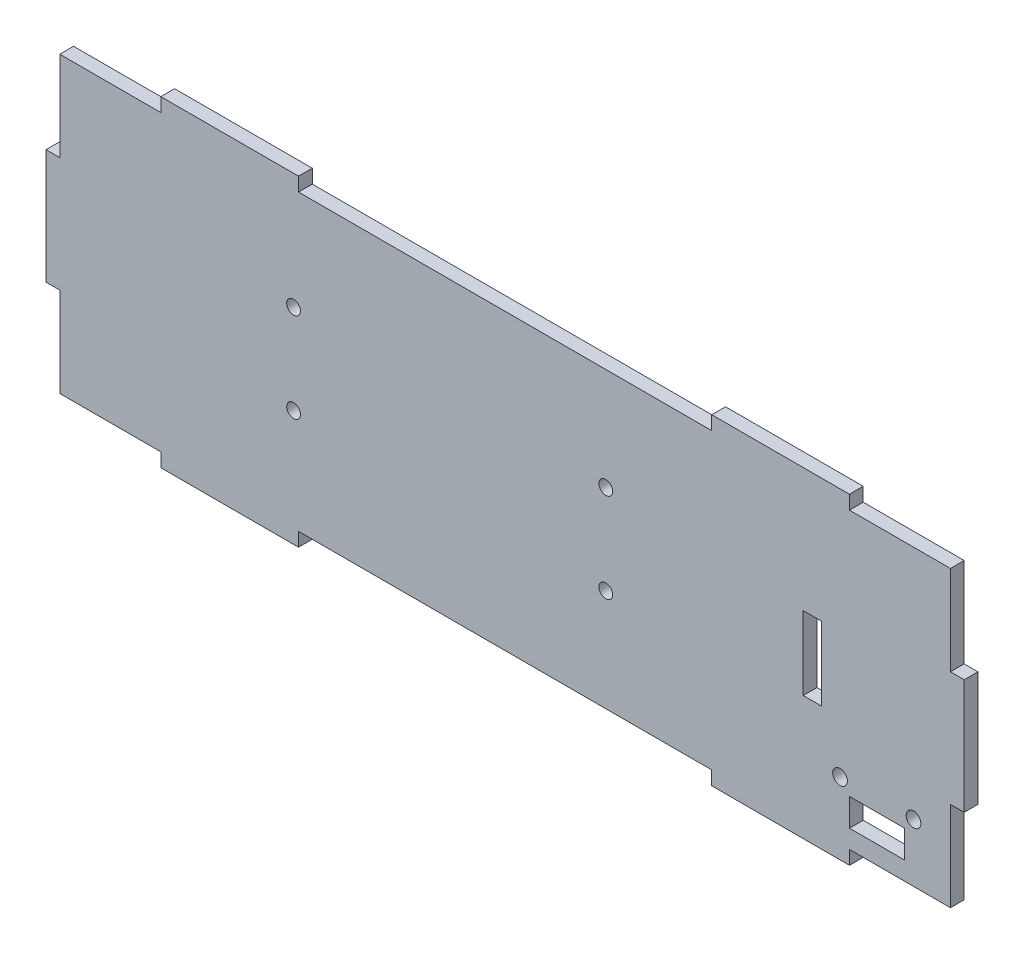
from build123d import *

# Parameters (mm, degrees)
SALIENTE_EXTRUIR1_DEPTH = 1.5
CROQUIS2_R              = 1.6
CORTAR_EXTRUIR1_DEPTH   = 10
CROQUIS3_W              = 12
CROQUIS3_H              = 6
CORTAR_EXTRUIR2_DEPTH   = 10
CROQUIS4_W              = 4
CROQUIS4_H              = 16
CORTAR_EXTRUIR3_DEPTH   = 10
CORTAR_EXTRUIR4_REACH   = 107.991
CROQUIS5_R              = 1.5


with BuildPart() as part:
    # Croquis1 → Saliente-Extruir1 (new, symmetric)
    with BuildSketch(Plane.XY):
        Polygon((-75, -32), (-75, -35), (-45, -35), (-45, -32), (45, -32), (45, -35), (75, -35), (75, -32), (97, -32), (97, -12.5), (100, -12.5), (100, 12.5), (97, 12.5), (97, 32), (75, 32), (75, 35), (45, 35), (45, 32), (-45, 32), (-45, 35), (-75, 35), (-75, 32), (-97, 32), (-97, 12.5), (-100, 12.5), (-100, -12.5), (-97, -12.5), (-97, -32), align=None)
    extrude(amount=SALIENTE_EXTRUIR1_DEPTH, both=True)

    # Croquis2 → Cortar-Extruir1 (cut)
    with BuildSketch(Plane.XY.offset(1.5)):
        with Locations((72.948592978, -19.354512833)):
            Circle(CROQUIS2_R)
        with Locations((88.948592978, -19.354512833)):
            Circle(CROQUIS2_R)
    extrude(amount=-CORTAR_EXTRUIR1_DEPTH, mode=Mode.SUBTRACT)

    # Croquis3 → Cortar-Extruir2 (cut)
    with BuildSketch(Plane.XY.offset(1.5)):
        with Locations((81, -25)):
            Rectangle(CROQUIS3_W, CROQUIS3_H)
    extrude(amount=-CORTAR_EXTRUIR2_DEPTH, mode=Mode.SUBTRACT)

    # Croquis4 → Cortar-Extruir3 (cut)
    with BuildSketch(Plane.XY.offset(1.5)):
        with Locations((66.93, 0)):
            Rectangle(CROQUIS4_W, CROQUIS4_H)
    extrude(amount=-CORTAR_EXTRUIR3_DEPTH, mode=Mode.SUBTRACT)

    # Croquis5 → Cortar-Extruir4 (cut, up to next)
    with BuildSketch(Plane.XY.offset(1.5), mode=Mode.PRIVATE) as cortar_extruir4_sk1:
        with Locations((21.93, 9.75)):
            Circle(CROQUIS5_R)
    cortar_extruir4_tool1 = extrude(cortar_extruir4_sk1.sketch, amount=-CORTAR_EXTRUIR4_REACH, mode=Mode.PRIVATE) & part.part
    # Croquis5 → Cortar-Extruir4 (cut, up to next)
    with BuildSketch(Plane.XY.offset(1.5), mode=Mode.PRIVATE) as cortar_extruir4_sk2:
        with Locations((21.93, -9.75)):
            Circle(CROQUIS5_R)
    cortar_extruir4_tool2 = extrude(cortar_extruir4_sk2.sketch, amount=-CORTAR_EXTRUIR4_REACH, mode=Mode.PRIVATE) & part.part
    # Croquis5 → Cortar-Extruir4 (cut, up to next)
    with BuildSketch(Plane.XY.offset(1.5), mode=Mode.PRIVATE) as cortar_extruir4_sk3:
        with Locations((-46.07, -9.75)):
            Circle(CROQUIS5_R)
    cortar_extruir4_tool3 = extrude(cortar_extruir4_sk3.sketch, amount=-CORTAR_EXTRUIR4_REACH, mode=Mode.PRIVATE) & part.part
    # Croquis5 → Cortar-Extruir4 (cut, up to next)
    with BuildSketch(Plane.XY.offset(1.5), mode=Mode.PRIVATE) as cortar_extruir4_sk4:
        with Locations((-46.07, 9.75)):
            Circle(CROQUIS5_R)
    cortar_extruir4_tool4 = extrude(cortar_extruir4_sk4.sketch, amount=-CORTAR_EXTRUIR4_REACH, mode=Mode.PRIVATE) & part.part
    add(cortar_extruir4_tool1.solids().sort_by_distance((21.93, 9.75, 1.5))[0], mode=Mode.SUBTRACT)
    add(cortar_extruir4_tool2.solids().sort_by_distance((21.93, -9.75, 1.5))[0], mode=Mode.SUBTRACT)
    add(cortar_extruir4_tool3.solids().sort_by_distance((-46.07, -9.75, 1.5))[0], mode=Mode.SUBTRACT)
    add(cortar_extruir4_tool4.solids().sort_by_distance((-46.07, 9.75, 1.5))[0], mode=Mode.SUBTRACT)


solid = part.part
